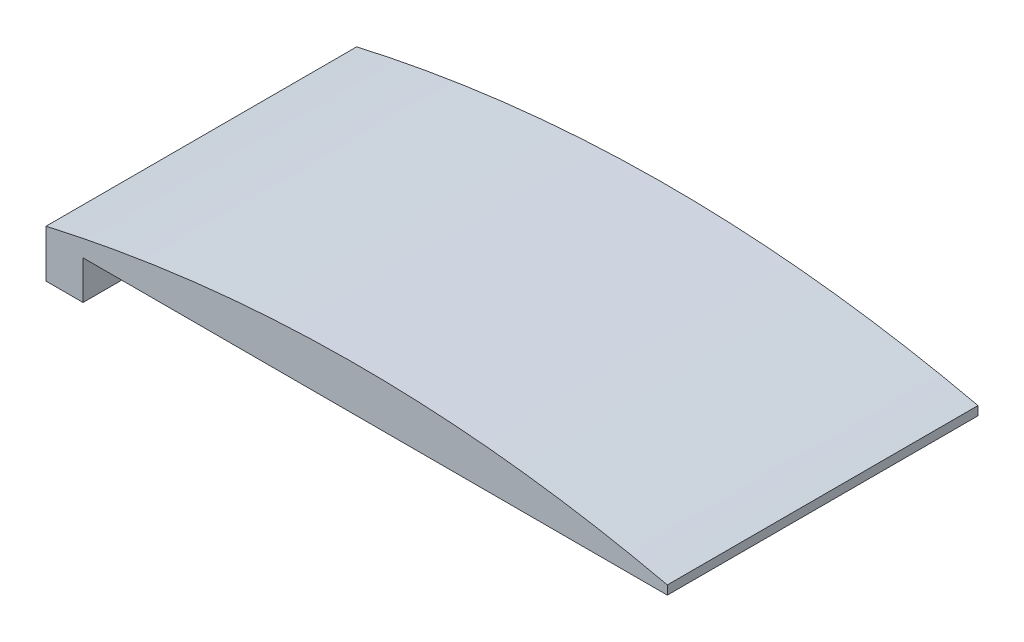
from build123d import *

# Parameters (mm, degrees)
SKETCH2_W           = 140
SKETCH2_H           = 70
BOSS_EXTRUDE1_DEPTH = 10
BOSS_EXTRUDE2_DEPTH = 70
SKETCH4_W           = 8.35
SKETCH4_H           = 10
BOSS_EXTRUDE3_DEPTH = 5
SKETCH5_W           = 8.35
SKETCH5_H           = 5.85
BOSS_EXTRUDE4_DEPTH = 65


with BuildPart() as part:
    # Sketch2 → Boss-Extrude1 (new body)
    with BuildSketch(Plane(origin=(0, 0, 0), x_dir=(1, 0, 0), z_dir=(0, 1, 0))):
        with Locations((70, 35)):
            Rectangle(SKETCH2_W, SKETCH2_H)
    extrude(amount=BOSS_EXTRUDE1_DEPTH)


with BuildPart() as body_2:
    # Sketch3 → Boss-Extrude2 (new body)
    with BuildSketch(Plane.XY):
        with BuildLine():
            Line((0, 0), (140, 0))
            Line((140, 0), (140, 2))
            add(Edge.make_bspline(
                [(0, 2), (70, 18), (140, 2)],
                knots=[0, 0, 0, 1, 1, 1], degree=2))
            Line((0, 2), (0, 0))
        make_face()
    extrude(amount=-BOSS_EXTRUDE2_DEPTH)

    # Combine1: intersect part
    add(part.part, mode=Mode.INTERSECT)

    # Sketch4 → Boss-Extrude3 (add)
    with BuildSketch(Plane.XY):
        with Locations((4.175, -3.716849325)):
            Rectangle(SKETCH4_W, SKETCH4_H)
    extrude(amount=-BOSS_EXTRUDE3_DEPTH)

    # Sketch5 → Boss-Extrude4 (add)
    with BuildSketch(Plane(origin=(0, 0, -5), x_dir=(-1, 0, 0), z_dir=(0, 0, -1))):
        with Locations((-4.175, -5.791849325)):
            Rectangle(SKETCH5_W, SKETCH5_H)
    extrude(amount=BOSS_EXTRUDE4_DEPTH)


solid = body_2.part
